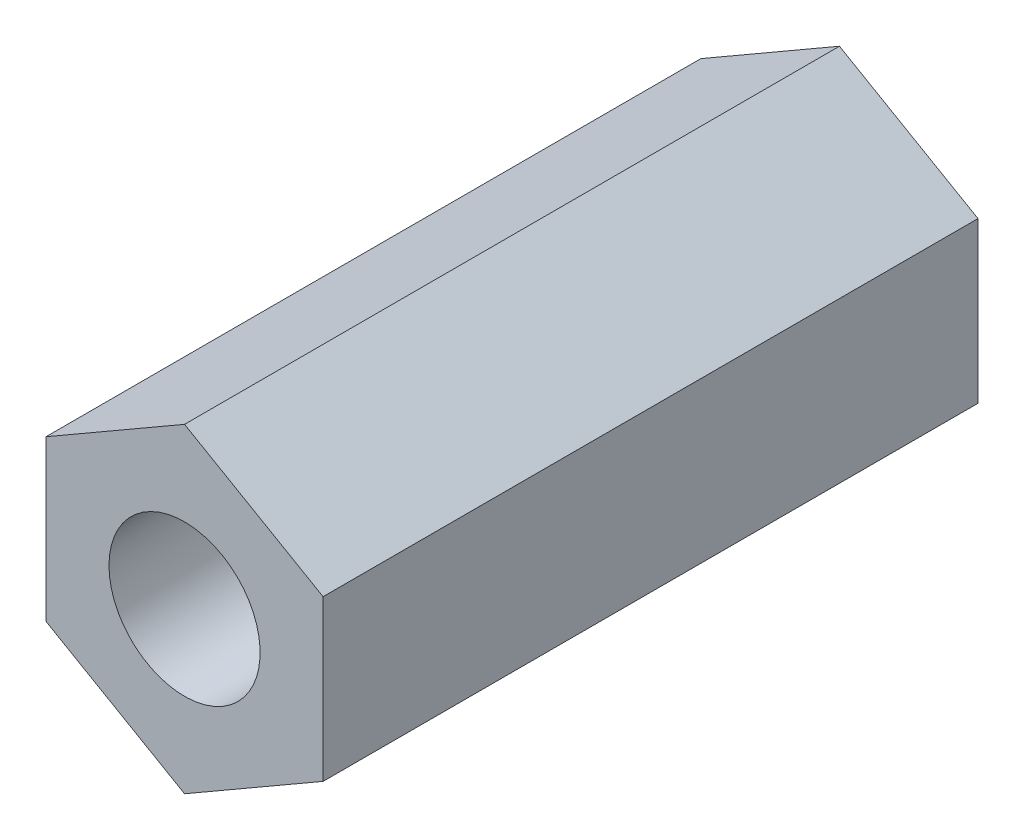
from build123d import *

# Parameters (mm, degrees)
ESQUISSE1_R        = 1.5
BOSS_EXTRU_1_DEPTH = 13


with BuildPart() as part:
    # Esquisse1 → Boss.-Extru.1 (new body)
    with BuildSketch(Plane.XY):
        Polygon((0, -3.175426481), (2.75, -1.58771324), (2.75, 1.58771324), (0, 3.175426481), (-2.75, 1.58771324), (-2.75, -1.58771324), align=None)
        with Locations(Location((0, 0, 0), (0, 0, 180))):
            Circle(ESQUISSE1_R, mode=Mode.SUBTRACT)
    extrude(amount=BOSS_EXTRU_1_DEPTH)


solid = part.part
